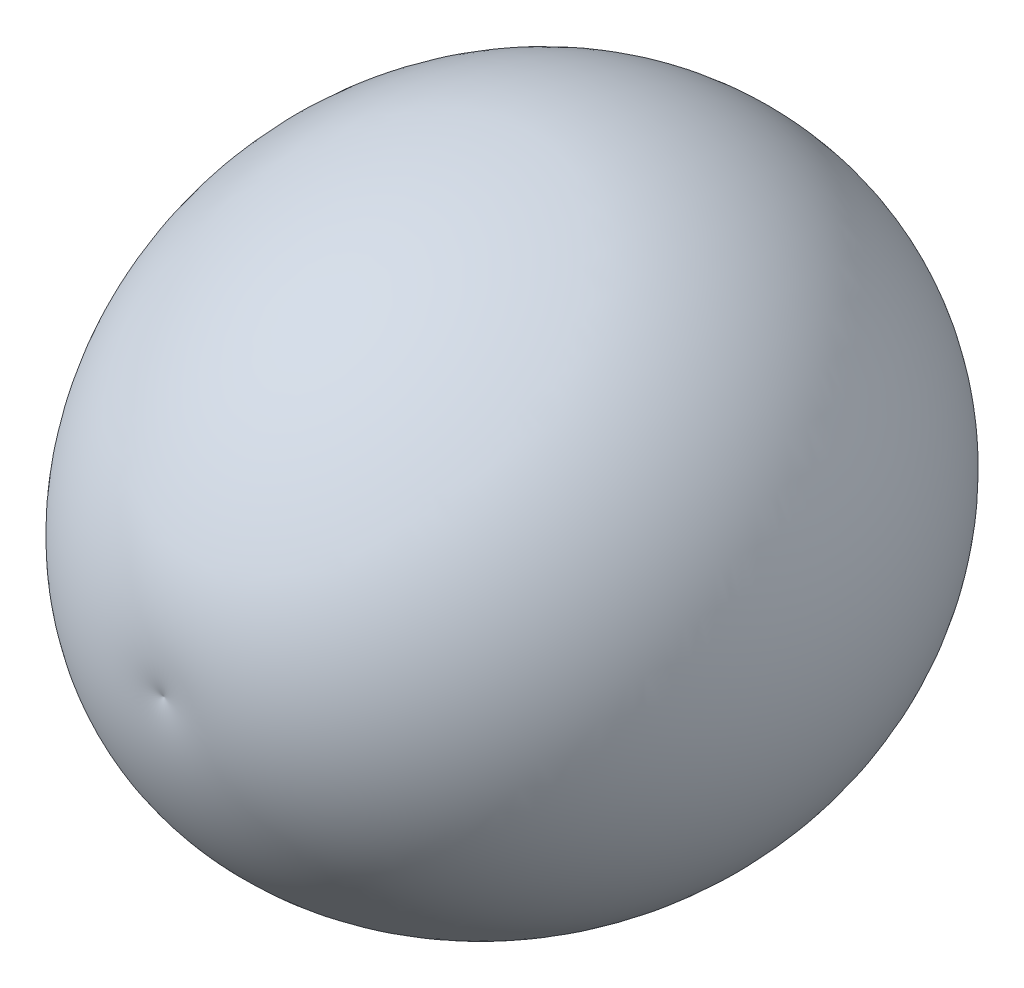
from build123d import *


with BuildPart() as part:
    # Sketch1 → Revolve1 (revolve)
    with BuildSketch(Plane(origin=(0, 0, 0), x_dir=(1, 0, 0), z_dir=(0, 1, 0))):
        with BuildLine():
            Line((0, 0), (0, 315.630233813))
            add(Edge.make_bspline(
                [(0, 0), (0.061796402, -0.026084469), (0.186171396, -0.076262552), (0.438119474, -0.168499764), (0.820492001, -0.294039895), (1.270669557, -0.427306606), (1.918970978, -0.599190095), (2.703101503, -0.780777898), (3.624412082, -0.962503809), (4.683573853, -1.135196434), (6.013220108, -1.312378734), (7.75032829, -1.482311209), (9.896589851, -1.601202761), (12.449865743, -1.62398658), (15.13694966, -1.529696128), (18.028832131, -1.312652987), (21.119670873, -0.954329211), (25.275053738, -0.299686804), (30.460743833, 0.810917114), (36.420171154, 2.478361379), (44.753748931, 5.425387402), (54.210294114, 9.67394425), (64.573893975, 15.507930083), (75.769903637, 23.330330375), (86.210333455, 32.134305795), (98.50395182, 44.507174063), (111.65834998, 61.207516383), (124.217702925, 82.638096105), (134.51174075, 109.088749805), (140.539244653, 136.823984778), (142.124712042, 165.165585837), (139.508921392, 189.870900705), (134.364211851, 210.498439849), (128.771836166, 225.403505698), (124.328767007, 235.036101676), (120.156246068, 242.82500582), (116.539727953, 248.898775734), (111.676015438, 256.276021483), (106.363151586, 263.342091753), (100.615477372, 270.059819183), (94.451995954, 276.392003819), (89.280323059, 281.211675458), (83.877384059, 285.770690998), (78.253864242, 290.054769276), (72.622051699, 293.912641916), (67.016645716, 297.364605166), (61.469103472, 300.433229088), (56.007644189, 303.142772213), (51.015675163, 305.345016608), (46.537894003, 307.115144281), (42.607797042, 308.521431149), (39.250395539, 309.623285069), (35.864625535, 310.635404654), (32.453451729, 311.556803844), (29.018159499, 312.386577486), (25.56297246, 313.123904135), (22.087317417, 313.768048933), (18.598813756, 314.318365893), (15.529245983, 314.717308437), (12.899678558, 314.999981496), (10.691229503, 315.195909235), (8.946554894, 315.328831667), (7.199682477, 315.434911108), (5.586575729, 315.516253721), (3.873997502, 315.574904238), (2.46068838, 315.61284331), (1.073542697, 315.627071903), (0.357487537, 315.630233813), (0, 315.630233813)],
                knots=[0, 0, 0, 0, 0, 0.000516629, 0.001033258, 0.002066517, 0.003099775, 0.004133033, 0.00619955, 0.008266066, 0.010332583, 0.012399099, 0.016532132, 0.021709029, 0.026885927, 0.032062824, 0.037239722, 0.044044845, 0.050849969, 0.064460216, 0.078070044, 0.091679873, 0.118899192, 0.144215767, 0.169532341, 0.196751872, 0.223971403, 0.27841054, 0.332849765, 0.387288816, 0.441727968, 0.496167109, 0.550606221, 0.577825779, 0.605045337, 0.618655117, 0.632264896, 0.645874675, 0.659484455, 0.686704006, 0.700313781, 0.713923557, 0.727533335, 0.741143113, 0.754752891, 0.768362669, 0.780100638, 0.791838607, 0.803576576, 0.815314545, 0.822119434, 0.828924324, 0.835729214, 0.842534103, 0.849338991, 0.856143879, 0.862948768, 0.869753656, 0.876558545, 0.883363434, 0.886765878, 0.890168323, 0.893570768, 0.896973212, 0.900002639, 0.903032065, 0.906061492, 0.909090918, 0.909090918, 0.909090918, 0.909090918, 0.909090918], degree=4))
        make_face()
    revolve(axis=Axis((0, 0, -315.630233813), (0, 0, 1)))


solid = part.part
